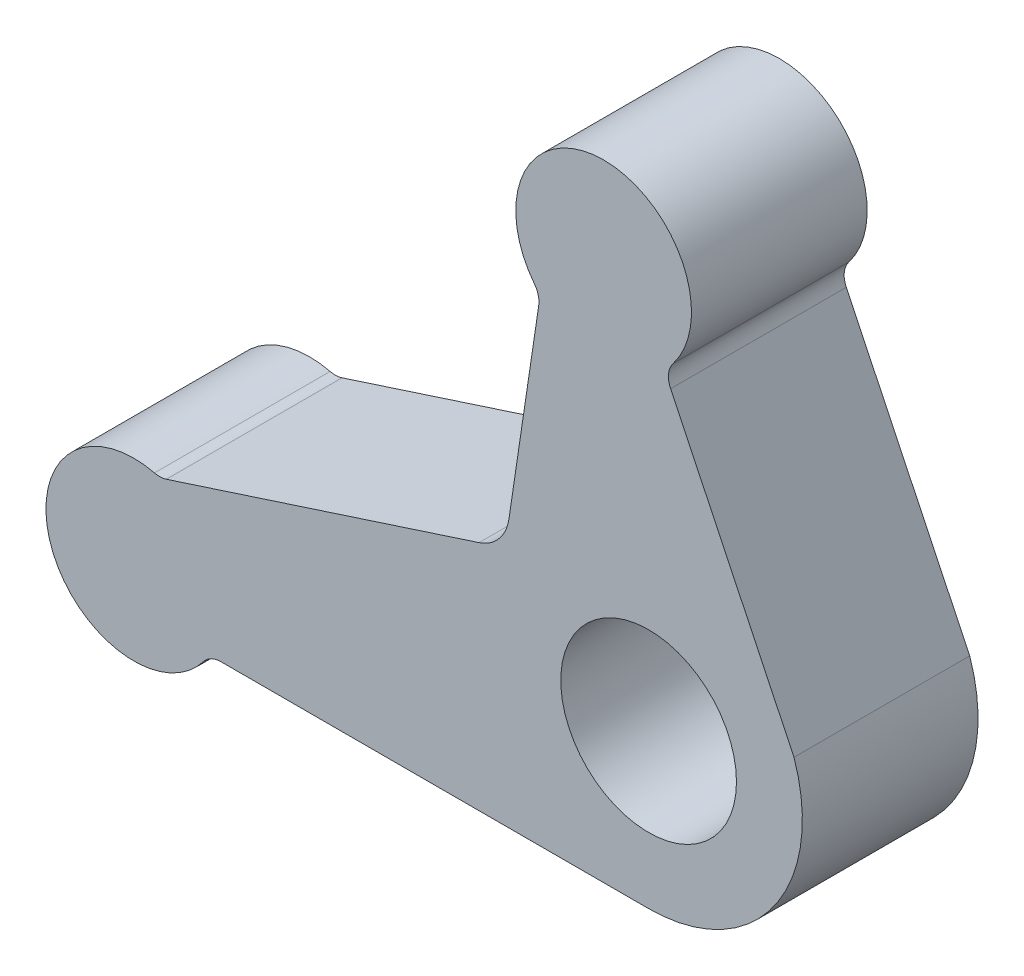
from build123d import *

# Parameters (mm, degrees)
ESQUISSE1_R  = 2
LEVIER_DEPTH = 4


with BuildPart() as part:
    # Esquisse1 → levier (new body)
    with BuildSketch(Plane.XY):
        with BuildLine():
            Line((0, -3.5), (-9.735750819, -3.5))
            ThreePointArc((-9.735750819, -3.5), (-9.956950447, -3.551590896), (-10.132502527, -3.695717102))
            ThreePointArc((-10.132502527, -3.695717102), (-13.605128686, -3.145248654), (-11.250178567, -0.534433094))
            ThreePointArc((-11.250178567, -0.534433094), (-11.113632555, -0.548025702), (-10.978533656, -0.52398698))
            Line((-10.978533656, -0.52398698), (-3.86030296, 1.785618641))
            ThreePointArc((-3.86030296, 1.785618641), (-3.405699101, 2.090673699), (-3.179852509, 2.589388623))
            Line((-3.179852509, 2.589388623), (-2.50174812, 7.13913306))
            ThreePointArc((-2.50174812, 7.13913306), (-2.512693838, 7.339879609), (-2.601824704, 7.520086919))
            ThreePointArc((-2.601824704, 7.520086919), (-1.025645596, 10.74907367), (0.555905376, 7.522714648))
            ThreePointArc((0.555905376, 7.522714648), (0.453712421, 7.269297469), (0.5, 7))
            Line((0.5, 7), (3.309621355, 1.138598475))
            ThreePointArc((3.309621355, 1.138598475), (2.849130978, -2.032843494), (0, -3.5))
        make_face()
        Circle(ESQUISSE1_R, mode=Mode.SUBTRACT)
    extrude(amount=LEVIER_DEPTH)


solid = part.part
